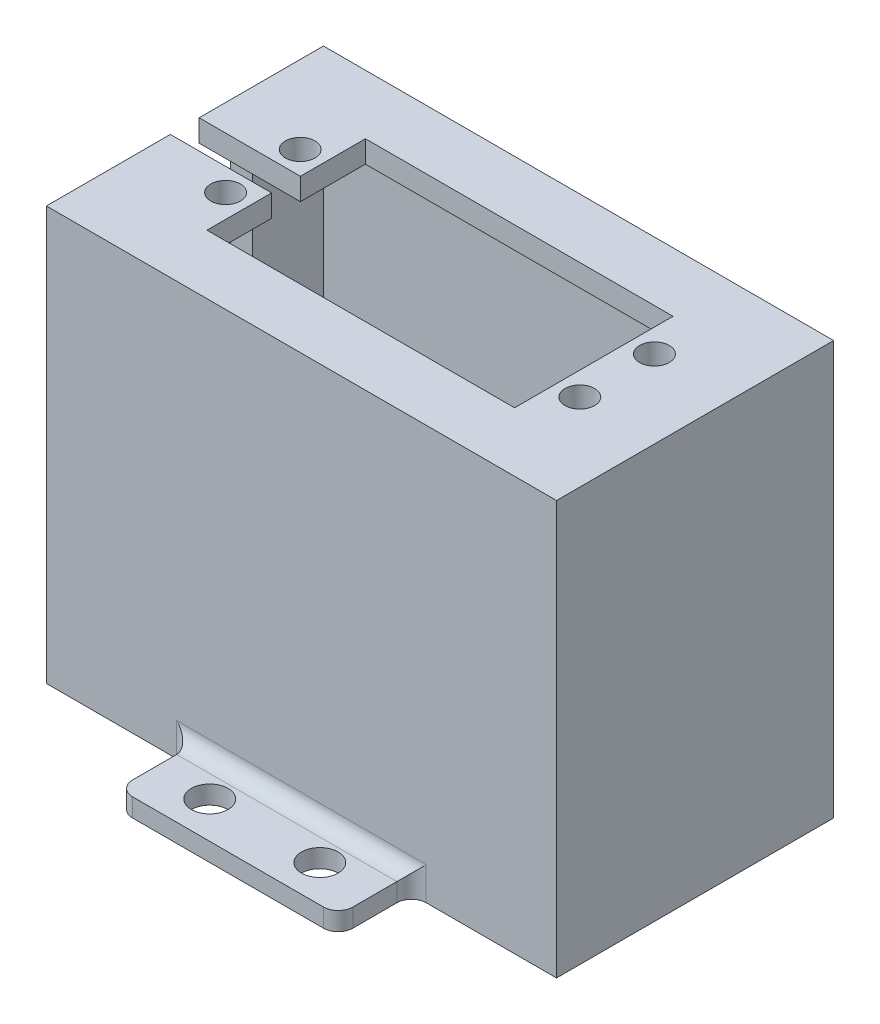
from build123d import *

# Parameters (mm, degrees)
SKETCH1_R              = 2.54
SKETCH1_R_2            = 6.35
MAINBASEPLATE_DEPTH    = 3
PANTILT_EXTRUDE6_DEPTH = 53.34
SKETCH11_W             = 69.5
SKETCH11_H             = 37.75
BOSS_EXTRUDE7_DEPTH    = 3
SKETCH12_R             = 2.0193
CUT_EXTRUDE3_DEPTH     = 56.34
SKETCH32_W             = 712.395528774
SKETCH32_H             = 524.196017535
CUT_EXTRUDE11_DEPTH    = 3
SKETCH33_W             = 30
SKETCH33_H             = 10
SKETCH33_R             = 2.5
BOSS_EXTRUDE9_DEPTH    = 2.5
FILLET1_R              = 2


with BuildPart() as part:
    # Sketch1 → mainbaseplate (new body)
    with BuildSketch(Plane(origin=(0, 0, 0), x_dir=(1, 0, 0), z_dir=(0, 1, 0))):
        with BuildLine():
            Line((-223.52, -111.125), (223.52, -111.125))
            ThreePointArc((223.52, -111.125), (227.112102448, -109.637102448), (228.6, -106.045))
            Line((228.6, -106.045), (228.6, 106.045))
            ThreePointArc((228.6, 106.045), (227.112102448, 109.637102448), (223.52, 111.125))
            Line((223.52, 111.125), (-223.52, 111.125))
            ThreePointArc((-223.52, 111.125), (-227.112102448, 109.637102448), (-228.6, 106.045))
            Line((-228.6, 106.045), (-228.6, -106.045))
            ThreePointArc((-228.6, -106.045), (-227.112102448, -109.637102448), (-223.52, -111.125))
        make_face()
        with Locations(Location((127, 36.5125, 0), (0, 0, 270))):
            Circle(SKETCH1_R, mode=Mode.SUBTRACT)
        with Locations(Location((127, -36.5125, 0), (0, 0, 270))):
            Circle(SKETCH1_R, mode=Mode.SUBTRACT)
        with Locations(Location((-142.24, 36.5125, 0), (0, 0, 270))):
            Circle(SKETCH1_R, mode=Mode.SUBTRACT)
        with Locations(Location((-142.24, -36.5125, 0), (0, 0, 270))):
            Circle(SKETCH1_R, mode=Mode.SUBTRACT)
        with Locations(Location((209.55, 0, 0), (0, 0, 270))):
            Circle(SKETCH1_R_2, mode=Mode.SUBTRACT)
    extrude(amount=MAINBASEPLATE_DEPTH)

    # Sketch10 → PanTilt-Extrude6 (add)
    with BuildSketch(Plane(origin=(0, 3, 0), x_dir=(1, 0, 0), z_dir=(0, 1, 0))):
        Polygon((104.95, 18.875), (174.45, 18.875), (174.45, -18.875), (104.95, -18.875), (104.95, -6.175), (107.95, -6.175), (107.95, -15.875), (171.45, -15.875), (171.45, 15.875), (107.95, 15.875), (107.95, 6.175), (104.95, 6.175), align=None)
    extrude(amount=PANTILT_EXTRUDE6_DEPTH)

    # Sketch11 → Boss-Extrude7 (add)
    with BuildSketch(Plane(origin=(0, 56.34, 0), x_dir=(1, 0, 0), z_dir=(0, 1, 0))):
        with Locations((139.7, 0)):
            Rectangle(SKETCH11_W, SKETCH11_H)
    extrude(amount=BOSS_EXTRUDE7_DEPTH)

    # Sketch12 → Cut-Extrude3 (cut)
    with BuildSketch(Plane(origin=(0, 59.34, 0), x_dir=(1, 0, 0), z_dir=(0, 1, 0))):
        with Locations(Location((163.83, 5.08, 0), (0, 0, 270))):
            Circle(SKETCH12_R)
        with Locations(Location((163.83, -5.08, 0), (0, 0, 270))):
            Circle(SKETCH12_R)
        with Locations(Location((115.57, 5.08, 0), (0, 0, 270))):
            Circle(SKETCH12_R)
        with Locations(Location((115.57, -5.08, 0), (0, 0, 270))):
            Circle(SKETCH12_R)
        Polygon((118.745, 1.937698292), (104.95, 1.937698292), (95.841621454, 0), (104.95, -1.990085687), (118.745, -1.990085687), (118.745, -10.795), (160.655, -10.795), (160.655, 10.795), (118.745, 10.795), align=None)
    extrude(amount=-CUT_EXTRUDE3_DEPTH, mode=Mode.SUBTRACT)

    # Sketch32 → Cut-Extrude11 (cut)
    with BuildSketch(Plane.XZ):
        with Locations((-5.907824988, 36.768742763)):
            Rectangle(SKETCH32_W, SKETCH32_H)
    extrude(amount=-CUT_EXTRUDE11_DEPTH, mode=Mode.SUBTRACT)

    # Sketch33 → Boss-Extrude9 (add)
    # profile 1 of 2: a face of its own
    with BuildSketch(Plane.XZ.offset(-3)):
        with Locations((139.7, 23.875)):
            Rectangle(SKETCH33_W, SKETCH33_H)
        with Locations(Location((132.2, 23.875, 0), (0, 0, 270))):
            Circle(SKETCH33_R, mode=Mode.SUBTRACT)
        with Locations(Location((147.2, 23.875, 0), (0, 0, 270))):
            Circle(SKETCH33_R, mode=Mode.SUBTRACT)
    # profile 2 of 2: a face of its own
    with BuildSketch(Plane.XZ.offset(-3)):
        with Locations((139.7, -23.875)):
            Rectangle(SKETCH33_W, SKETCH33_H)
        with Locations(Location((132.2, -23.875, 0), (0, 0, 270))):
            Circle(SKETCH33_R, mode=Mode.SUBTRACT)
        with Locations(Location((147.2, -23.875, 0), (0, 0, 270))):
            Circle(SKETCH33_R, mode=Mode.SUBTRACT)
    extrude(amount=-BOSS_EXTRUDE9_DEPTH)

    # Fillet1
    fillet1_edges = [part.edges().sort_by_distance(p)[0] for p in [
        (124.7, 4.25, 28.875),
        (154.7, 4.25, 28.875),
        (154.7, 4.25, 18.875),
        (124.7, 4.25, 18.875),
        (139.7, 5.5, 18.875),
        (124.7, 4.25, -18.875),
        (154.7, 4.25, -18.875),
        (154.7, 4.25, -28.875),
        (124.7, 4.25, -28.875),
        (139.7, 5.5, -18.875),
    ]]
    fillet(fillet1_edges, radius=FILLET1_R)


solid = part.part
